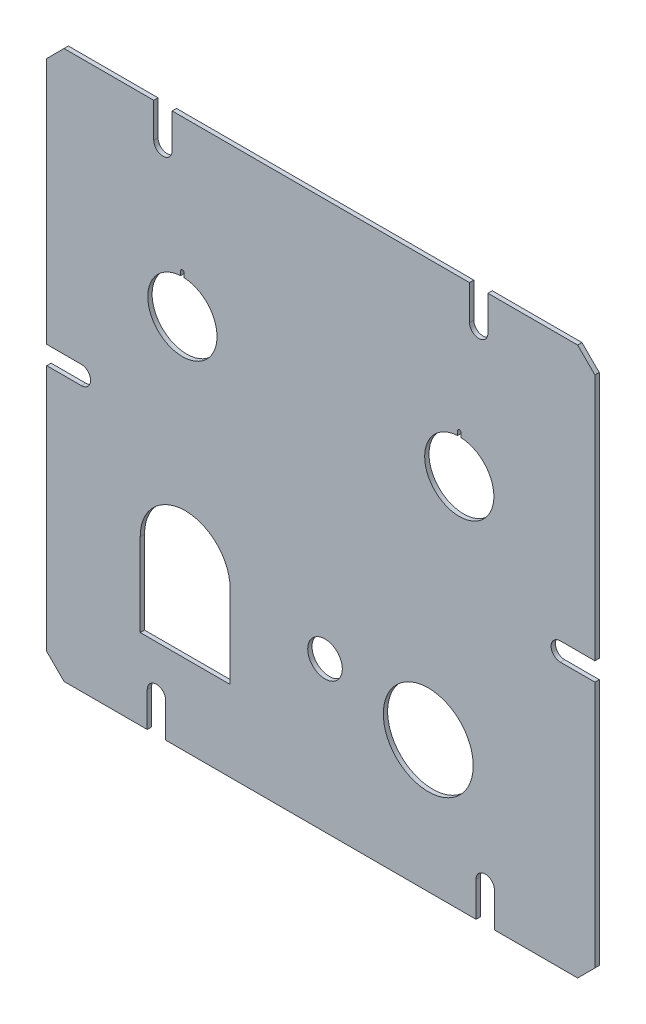
from build123d import *

# Parameters (mm, degrees)
SKETCH1_W                 = 201.168
SKETCH1_H                 = 201.168
BOSS_EXTRUDE1_DEPTH       = 1.5875
CUT_EXTRUDE1_REACH        = 144.256
SKETCH2_R                 = 16.5
F_1_4_CLEARANCE_HOLE1_D   = 6.7564
CHAMFER1_SIZE             = 6.35
CUT_EXTRUDE3_REACH        = 144.256
CUT_EXTRUDE4_REACH        = 144.256
CUT_EXTRUDE5_REACH        = 144.256
SKETCH7_W                 = 6.7564
SKETCH7_H                 = 14.478
SKETCH7_W_2               = 14.478
SKETCH7_H_2               = 6.7564
PORT_FOR_POWER_PLUG_REACH = 144.256
SKETCH8_R                 = 6.35


with BuildPart() as part:
    # Sketch1 → Boss-Extrude1 (new body)
    with BuildSketch(Plane.XY):
        Rectangle(SKETCH1_W, SKETCH1_H)
    extrude(amount=BOSS_EXTRUDE1_DEPTH)

    # Sketch2 → Cut-Extrude1 (cut, up to next)
    with BuildSketch(Plane.XY.offset(1.5875), mode=Mode.PRIVATE) as cut_extrude1_sk1:
        with Locations((-49.784, -40.5765)):
            Circle(SKETCH2_R)
    cut_extrude1_tool1 = extrude(cut_extrude1_sk1.sketch, amount=-CUT_EXTRUDE1_REACH, mode=Mode.PRIVATE) & part.part
    # Sketch2 → Cut-Extrude1 (cut, up to next)
    with BuildSketch(Plane.XY.offset(1.5875), mode=Mode.PRIVATE) as cut_extrude1_sk2:
        with Locations((39.4206, -52.284)):
            Circle(SKETCH2_R)
    cut_extrude1_tool2 = extrude(cut_extrude1_sk2.sketch, amount=-CUT_EXTRUDE1_REACH, mode=Mode.PRIVATE) & part.part
    add(cut_extrude1_tool1.solids().sort_by_distance((-49.784, -40.5765, 1.5875))[0], mode=Mode.SUBTRACT)
    add(cut_extrude1_tool2.solids().sort_by_distance((39.4206, -52.284, 1.5875))[0], mode=Mode.SUBTRACT)

    # 1/4 Clearance Hole1 (through all)
    with Locations(Plane.XY.offset(1.5875)):
        with Locations((-57.94375, 87.884), (57.94375, 87.884), (87.884, 0), (-87.884, 0), (-60.325, -87.884), (60.325, -87.884)):
            Hole(F_1_4_CLEARANCE_HOLE1_D / 2)

    # Chamfer1
    chamfer1_edges = [part.edges().sort_by_distance(p)[0] for p in [
        (100.584, -100.584, 0.79375),
        (-100.584, -100.584, 0.79375),
        (-100.584, 100.584, 0.79375),
        (100.584, 100.584, 0.79375),
    ]]
    chamfer(chamfer1_edges, length=CHAMFER1_SIZE)

    # Sketch5 → Cut-Extrude3 (cut, up to next)
    with BuildSketch(Plane(origin=(0, 0, 0), x_dir=(-1, 0, 0), z_dir=(0, 0, -1)), mode=Mode.PRIVATE) as cut_extrude3_sk1:
        with BuildLine():
            Line((33.284, -40.5765), (33.284, -71.0565))
            Line((33.284, -71.0565), (66.284, -71.0565))
            Line((66.284, -71.0565), (66.284, -40.5765))
            ThreePointArc((66.284, -40.5765), (49.784, -57.0765), (33.284, -40.5765))
        make_face()
    cut_extrude3_tool1 = extrude(cut_extrude3_sk1.sketch, amount=-CUT_EXTRUDE3_REACH, mode=Mode.PRIVATE) & part.part
    add(cut_extrude3_tool1.solids().sort_by_distance((-49.784, -61.908997, 0))[0], mode=Mode.SUBTRACT)

    # Sketch6 → Cut-Extrude4 (cut, up to next)
    with BuildSketch(Plane(origin=(0, 0, 0), x_dir=(-1, 0, 0), z_dir=(0, 0, -1)), mode=Mode.PRIVATE) as cut_extrude4_sk1:
        with BuildLine():
            Line((-50.165, 49.768115066), (-50.165, 51.308))
            ThreePointArc((-50.165, 51.308), (-50.8, 51.943), (-51.435, 51.308))
            Line((-51.435, 51.308), (-51.435, 49.768115066))
            ThreePointArc((-51.435, 49.768115066), (-50.8, 24.384), (-50.165, 49.768115066))
        make_face()
    cut_extrude4_tool1 = extrude(cut_extrude4_sk1.sketch, amount=-CUT_EXTRUDE4_REACH, mode=Mode.PRIVATE) & part.part
    # Sketch6 → Cut-Extrude4 (cut, up to next)
    with BuildSketch(Plane(origin=(0, 0, 0), x_dir=(-1, 0, 0), z_dir=(0, 0, -1)), mode=Mode.PRIVATE) as cut_extrude4_sk2:
        with BuildLine():
            Line((51.435, 49.768115066), (51.435, 51.308))
            ThreePointArc((51.435, 51.308), (50.8, 51.943), (50.165, 51.308))
            Line((50.165, 51.308), (50.165, 49.768115066))
            ThreePointArc((50.165, 49.768115066), (50.8, 24.384), (51.435, 49.768115066))
        make_face()
    cut_extrude4_tool2 = extrude(cut_extrude4_sk2.sketch, amount=-CUT_EXTRUDE4_REACH, mode=Mode.PRIVATE) & part.part
    add(cut_extrude4_tool1.solids().sort_by_distance((50.8, 37.153354, 0))[0], mode=Mode.SUBTRACT)
    add(cut_extrude4_tool2.solids().sort_by_distance((-50.8, 37.153354, 0))[0], mode=Mode.SUBTRACT)

    # Sketch7 → Cut-Extrude5 (cut, up to next)
    with BuildSketch(Plane(origin=(0, 0, 0), x_dir=(-1, 0, 0), z_dir=(0, 0, -1)), mode=Mode.PRIVATE) as cut_extrude5_sk1:
        with Locations((-57.94375, 95.123)):
            Rectangle(SKETCH7_W, SKETCH7_H)
    cut_extrude5_tool1 = extrude(cut_extrude5_sk1.sketch, amount=-CUT_EXTRUDE5_REACH, mode=Mode.PRIVATE) & part.part
    # Sketch7 → Cut-Extrude5 (cut, up to next)
    with BuildSketch(Plane(origin=(0, 0, 0), x_dir=(-1, 0, 0), z_dir=(0, 0, -1)), mode=Mode.PRIVATE) as cut_extrude5_sk2:
        with Locations((57.94375, 95.123)):
            Rectangle(SKETCH7_W, SKETCH7_H)
    cut_extrude5_tool2 = extrude(cut_extrude5_sk2.sketch, amount=-CUT_EXTRUDE5_REACH, mode=Mode.PRIVATE) & part.part
    # Sketch7 → Cut-Extrude5 (cut, up to next)
    with BuildSketch(Plane(origin=(0, 0, 0), x_dir=(-1, 0, 0), z_dir=(0, 0, -1)), mode=Mode.PRIVATE) as cut_extrude5_sk3:
        with Locations((95.123, 0)):
            Rectangle(SKETCH7_W_2, SKETCH7_H_2)
    cut_extrude5_tool3 = extrude(cut_extrude5_sk3.sketch, amount=-CUT_EXTRUDE5_REACH, mode=Mode.PRIVATE) & part.part
    # Sketch7 → Cut-Extrude5 (cut, up to next)
    with BuildSketch(Plane(origin=(0, 0, 0), x_dir=(-1, 0, 0), z_dir=(0, 0, -1)), mode=Mode.PRIVATE) as cut_extrude5_sk4:
        with Locations((60.325, -95.123)):
            Rectangle(SKETCH7_W, SKETCH7_H)
    cut_extrude5_tool4 = extrude(cut_extrude5_sk4.sketch, amount=-CUT_EXTRUDE5_REACH, mode=Mode.PRIVATE) & part.part
    # Sketch7 → Cut-Extrude5 (cut, up to next)
    with BuildSketch(Plane(origin=(0, 0, 0), x_dir=(-1, 0, 0), z_dir=(0, 0, -1)), mode=Mode.PRIVATE) as cut_extrude5_sk5:
        with Locations((-60.325, -95.123)):
            Rectangle(SKETCH7_W, SKETCH7_H)
    cut_extrude5_tool5 = extrude(cut_extrude5_sk5.sketch, amount=-CUT_EXTRUDE5_REACH, mode=Mode.PRIVATE) & part.part
    # Sketch7 → Cut-Extrude5 (cut, up to next)
    with BuildSketch(Plane(origin=(0, 0, 0), x_dir=(-1, 0, 0), z_dir=(0, 0, -1)), mode=Mode.PRIVATE) as cut_extrude5_sk6:
        with Locations((-95.123, 0)):
            Rectangle(SKETCH7_W_2, SKETCH7_H_2)
    cut_extrude5_tool6 = extrude(cut_extrude5_sk6.sketch, amount=-CUT_EXTRUDE5_REACH, mode=Mode.PRIVATE) & part.part
    add(cut_extrude5_tool1.solids().sort_by_distance((57.94375, 95.123, 0))[0], mode=Mode.SUBTRACT)
    add(cut_extrude5_tool2.solids().sort_by_distance((-57.94375, 95.123, 0))[0], mode=Mode.SUBTRACT)
    add(cut_extrude5_tool3.solids().sort_by_distance((-95.123, 0, 0))[0], mode=Mode.SUBTRACT)
    add(cut_extrude5_tool4.solids().sort_by_distance((-60.325, -95.123, 0))[0], mode=Mode.SUBTRACT)
    add(cut_extrude5_tool5.solids().sort_by_distance((60.325, -95.123, 0))[0], mode=Mode.SUBTRACT)
    add(cut_extrude5_tool6.solids().sort_by_distance((95.123, 0, 0))[0], mode=Mode.SUBTRACT)

    # Sketch8 → PORT FOR POWER PLUG (cut, up to next)
    with BuildSketch(Plane(origin=(0, 0, 0), x_dir=(-1, 0, 0), z_dir=(0, 0, -1)), mode=Mode.PRIVATE) as port_for_power_plug_sk1:
        with Locations((-1.533105196, -45.535092969)):
            Circle(SKETCH8_R)
    port_for_power_plug_tool1 = extrude(port_for_power_plug_sk1.sketch, amount=-PORT_FOR_POWER_PLUG_REACH, mode=Mode.PRIVATE) & part.part
    add(port_for_power_plug_tool1.solids().sort_by_distance((1.533105, -45.535093, 0))[0], mode=Mode.SUBTRACT)


solid = part.part
